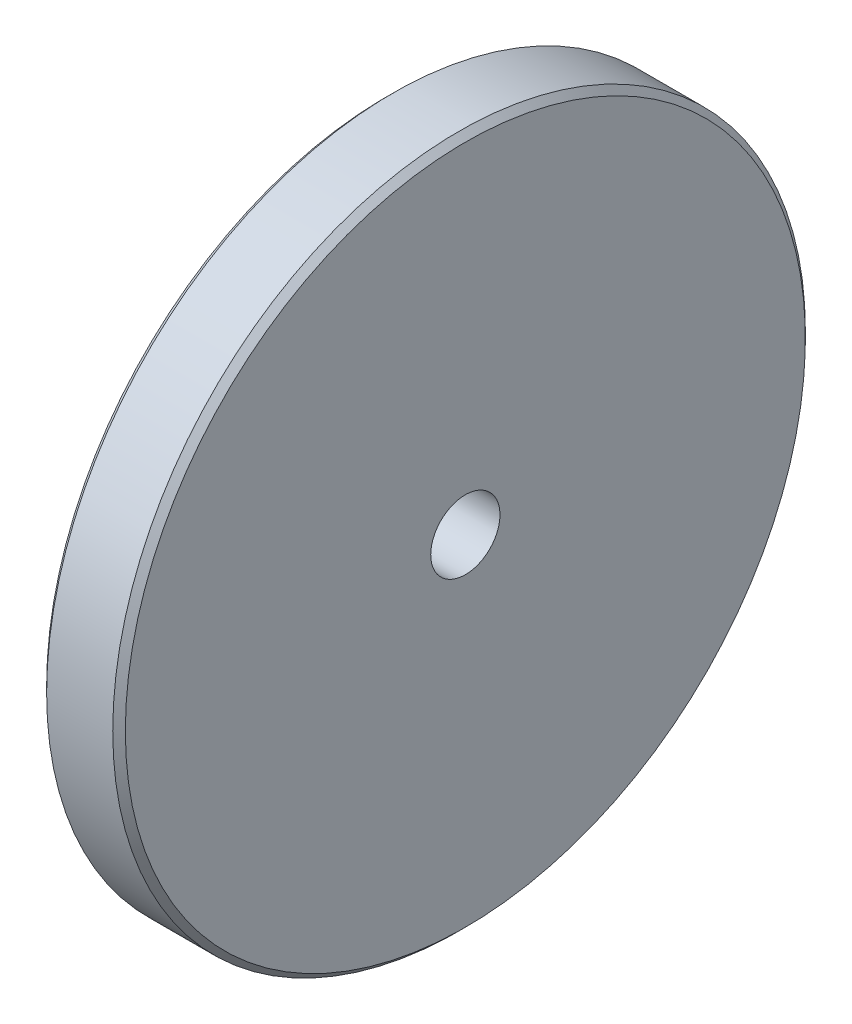
from build123d import *


with BuildPart() as part:
    # Skizze1 → Rotation1 (revolve)
    with BuildSketch(Plane(origin=(0, 0, 0), x_dir=(1, 0, 0), z_dir=(0, 1, 0)), mode=Mode.PRIVATE) as rotation1_sk:
        Polygon((0, 108), (0, 11), (25, 11), (25, 108), (23, 110), (2, 110), align=None)
    revolve(rotation1_sk.sketch.rotate(Axis((0, 0, 0), (1, 0, 0)), 180), axis=Axis((0, 0, 0), (1, 0, 0)))


solid = part.part
